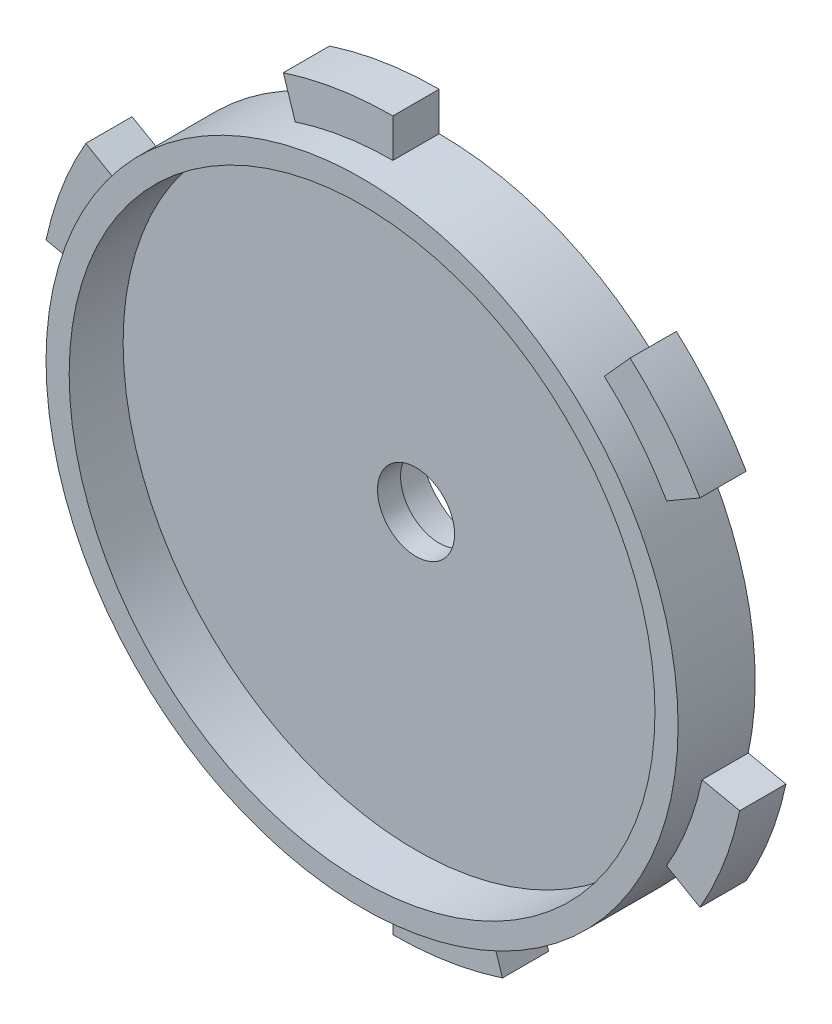
from build123d import *

# Parameters (mm, degrees)
SKETCH1_R               = 41
BOSS_EXTRUDE2_DEPTH     = 10
SHELL2_T                = -3
CUT_EXTRUDE1_DEPTH      = 59.838762733
CUT_EXTRUDE1_DEPTH_BACK = 59.838762733
SKETCH1_4_R             = 5
SKETCH3_R               = 10
SKETCH3_R_2             = 8
BOSS_EXTRUDE4_DEPTH     = 5.5
BOSS_EXTRUDE5_DEPTH     = 6


with BuildPart() as part:
    # Sketch1 → Boss-Extrude2 (new body)
    with BuildSketch(Plane.XY):
        Circle(SKETCH1_R)
    extrude(amount=BOSS_EXTRUDE2_DEPTH)

    # Shell2
    shell2_openings = [part.faces().sort_by_distance(p)[0] for p in [
        (0, 0, 10),
    ]]
    offset(amount=SHELL2_T, openings=shell2_openings, kind=Kind.INTERSECTION)

    # Sketch1<4> → Cut-Extrude1 (cut, two sides: drawn at the far end of the back side and taken through both)
    with BuildSketch(Plane.XY.offset(-CUT_EXTRUDE1_DEPTH_BACK)):
        Circle(SKETCH1_4_R)
    extrude(amount=CUT_EXTRUDE1_DEPTH + CUT_EXTRUDE1_DEPTH_BACK, mode=Mode.SUBTRACT)

    # Sketch3 → Boss-Extrude4 (add)
    with BuildSketch(Plane(origin=(0, 0, 0), x_dir=(-1, 0, 0), z_dir=(0, 0, -1))):
        Circle(SKETCH3_R)
        Circle(SKETCH3_R_2, mode=Mode.SUBTRACT)
    extrude(amount=BOSS_EXTRUDE4_DEPTH)

    # Sketch4 → Boss-Extrude5 (add)
    with BuildSketch(Plane(origin=(0, 0, 0), x_dir=(-1, 0, 0), z_dir=(0, 0, -1))):
        with BuildLine():
            Line((0, 46), (0, 41))
            ThreePointArc((0, 41), (6.413813067, 40.495221964), (12.669696769, 38.993317168))
            Line((12.669696769, 38.993317168), (14.214781741, 43.74859975))
            ThreePointArc((14.214781741, 43.74859975), (7.195985392, 45.433663667), (0, 46))
        make_face()
        with BuildLine():
            Line((39.837168574, 23), (35.507041555, 20.5))
            ThreePointArc((35.507041555, 20.5), (38.276797486, 14.693085931), (40.10405163, 8.524379324))
            Line((40.10405163, 8.524379324), (44.994789634, 9.563937778))
            ThreePointArc((44.994789634, 9.563937778), (42.944699619, 16.484925679), (39.837168574, 23))
        make_face()
        with BuildLine():
            Line((39.837168574, -23), (35.507041555, -20.5))
            ThreePointArc((35.507041555, -20.5), (31.86298442, -25.802136033), (27.434354861, -30.468937845))
            Line((27.434354861, -30.468937845), (30.780007893, -34.184661972))
            ThreePointArc((30.780007893, -34.184661972), (35.748714227, -28.948737988), (39.837168574, -23))
        make_face()
        with BuildLine():
            Line((0, -46), (0, -41))
            ThreePointArc((0, -41), (-6.413813067, -40.495221964), (-12.669696769, -38.993317168))
            Line((-12.669696769, -38.993317168), (-14.214781741, -43.74859975))
            ThreePointArc((-14.214781741, -43.74859975), (-7.195985392, -45.433663667), (0, -46))
        make_face()
        with BuildLine():
            Line((-39.837168574, -23), (-35.507041555, -20.5))
            ThreePointArc((-35.507041555, -20.5), (-38.276797486, -14.693085931), (-40.10405163, -8.524379324))
            Line((-40.10405163, -8.524379324), (-44.994789634, -9.563937778))
            ThreePointArc((-44.994789634, -9.563937778), (-42.944699619, -16.484925679), (-39.837168574, -23))
        make_face()
        with BuildLine():
            Line((-39.837168574, 23), (-35.507041555, 20.5))
            ThreePointArc((-35.507041555, 20.5), (-31.86298442, 25.802136033), (-27.434354861, 30.468937845))
            Line((-27.434354861, 30.468937845), (-30.780007893, 34.184661972))
            ThreePointArc((-30.780007893, 34.184661972), (-35.748714227, 28.948737988), (-39.837168574, 23))
        make_face()
    extrude(amount=-BOSS_EXTRUDE5_DEPTH)


solid = part.part
